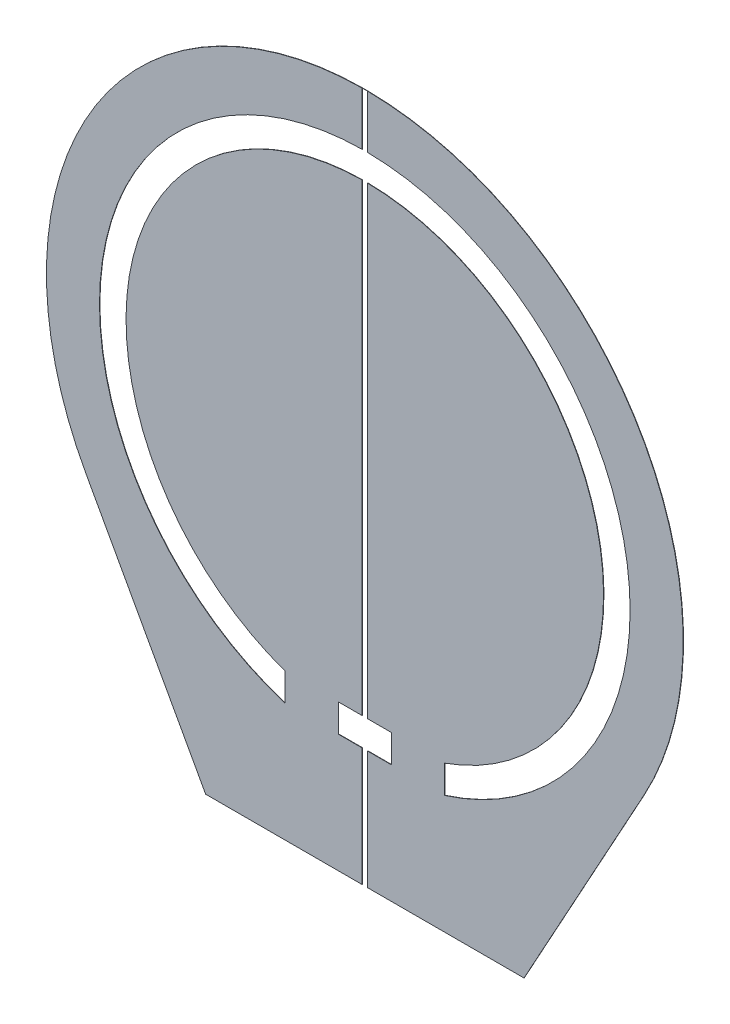
from build123d import *

# Parameters (mm, degrees)
BOSS_EXTRUDE1_DEPTH = 0.03556
SKETCH3_W           = 0.5
SKETCH3_H           = 7.500347247
SKETCH3_H_2         = 13.786796599
CUT_EXTRUDE2_DEPTH  = 1


with BuildPart() as part:
    # Sketch2 → Boss-Extrude1 (new body)
    with BuildSketch(Plane.XY):
        with BuildLine():
            Line((-7.5, -35.000000035), (0, -35.000000035))
            Line((0, -35.000000035), (7.5, -35.000000035))
            Line((7.5, -35.000000035), (15, -35.000000035))
            Line((15, -35.000000035), (26.292884658, -14.44590656))
            ThreePointArc((26.292884658, -14.44590656), (0, 30), (-26.292884658, -14.44590656))
            Line((-26.292884658, -14.44590656), (-15, -35.000000035))
            Line((-15, -35.000000035), (-7.5, -35.000000035))
        make_face()
        with BuildLine():
            Line((0.25, 22.498611068), (0.25, -21.213203436))
            Line((0.25, -21.213203436), (2.5, -21.213203436))
            Line((2.5, -21.213203436), (2.5, -23.848480036))
            Line((2.5, -23.848480036), (-2.5, -23.848480036))
            Line((-2.5, -23.848480036), (-2.5, -21.213203436))
            Line((-2.5, -21.213203436), (-0.25, -21.213203436))
            Line((-0.25, -21.213203436), (-0.25, 22.498611068))
            ThreePointArc((-0.25, 22.498611068), (-22.196763431, 3.681534082), (-7.5, -21.213203436))
            Line((-7.5, -21.213203436), (-7.5, -23.848480035))
            ThreePointArc((-7.5, -23.848480035), (0, 25), (7.5, -23.848480035))
            Line((7.5, -23.848480035), (7.5, -21.213203436))
            ThreePointArc((7.5, -21.213203436), (22.196763431, 3.681534082), (0.25, 22.498611068))
        make_face(mode=Mode.SUBTRACT)
    extrude(amount=BOSS_EXTRUDE1_DEPTH)

    # Sketch3 → Cut-Extrude2 (cut)
    with BuildSketch(Plane.XY.offset(0.03556)):
        with Locations((0, 26.248784692)):
            Rectangle(SKETCH3_W, SKETCH3_H)
        with Locations((0, -28.106601735)):
            Rectangle(SKETCH3_W, SKETCH3_H_2)
    extrude(amount=-CUT_EXTRUDE2_DEPTH, mode=Mode.SUBTRACT)


solid = part.part
